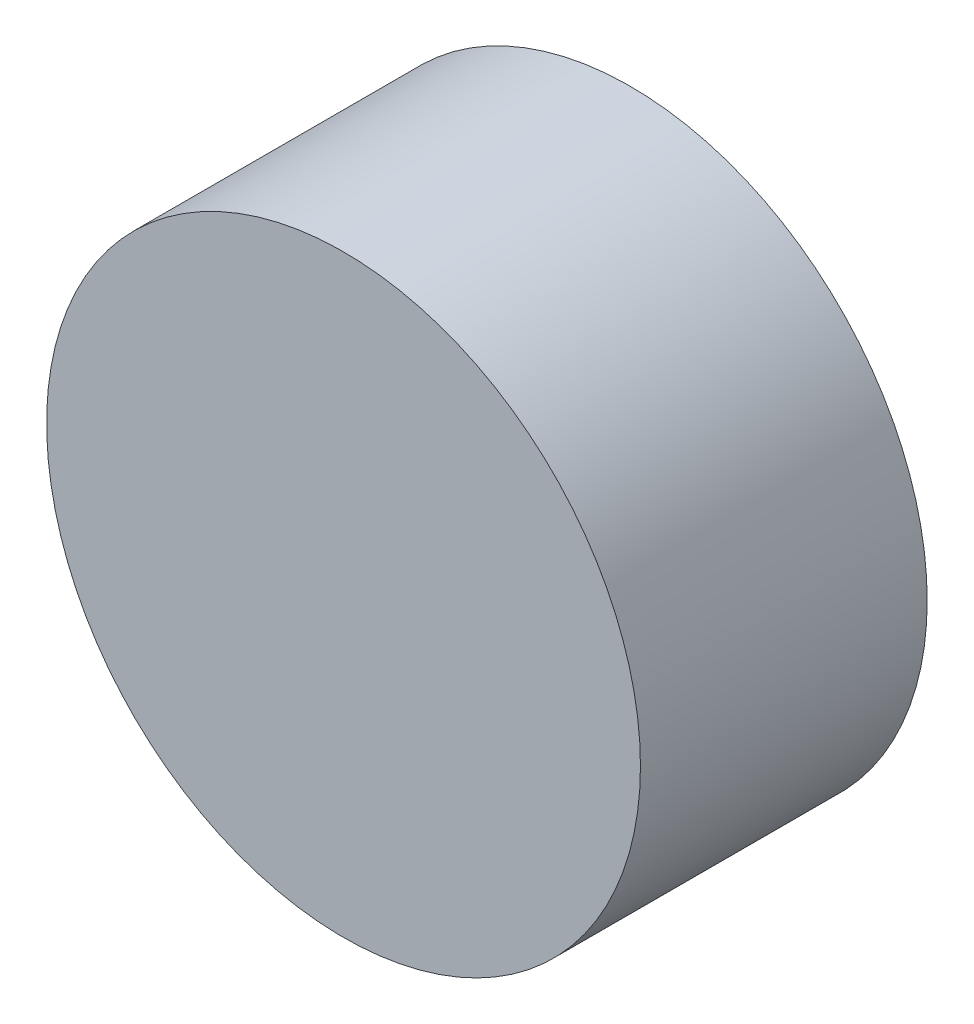
from build123d import *

# Parameters (mm, degrees)
SKETCH_1_R        = 35
EXTRUDE_203_DEPTH = 33.8


with BuildPart() as part:
    # 草图1 → Extrude 203 (new body)
    with BuildSketch(Plane.XY):
        Circle(SKETCH_1_R)
    extrude(amount=EXTRUDE_203_DEPTH)


solid = part.part
